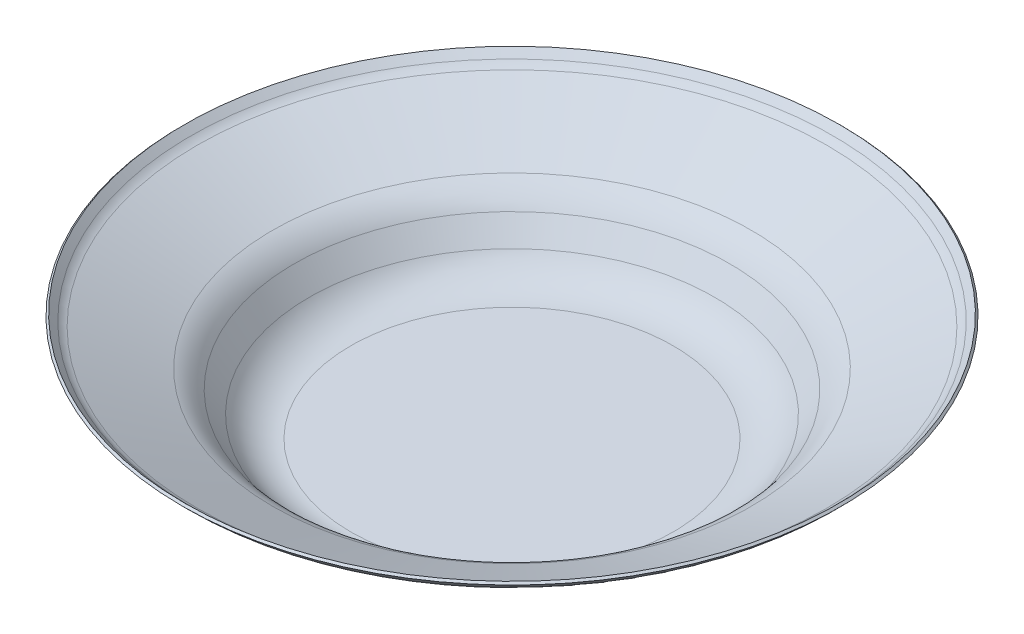
from build123d import *


with BuildPart() as part:
    # Sketch1 → Revolve-Thin2 (revolve)
    with BuildSketch(Plane.XY, mode=Mode.PRIVATE) as revolve_thin2_sk:
        with BuildLine():
            Line((0, 0), (-30.323190326, 0))
            ThreePointArc((-30.323190326, 0), (-34.9291722, 1.123912406), (-38.499810041, 4.243013806))
            Line((-38.499810041, 4.243013806), (-41.339639807, 8.276410321))
            ThreePointArc((-41.339639807, 8.276410321), (-43.060923254, 10.156742614), (-45.201704548, 11.540766343))
            Line((-45.201704548, 11.540766343), (-59.366864821, 18.315408212))
            ThreePointArc((-59.366864821, 18.315408212), (-60.097449611, 18.744382189), (-60.74512124, 19.290545415))
            Line((-60.74512124, 19.290545415), (-61.963641622, 20.509065797))
            Line((-61.963641622, 20.509065797), (-61.610088232, 20.862619188))
            Line((-61.610088232, 20.862619188), (-60.391567849, 19.644098805))
            ThreePointArc((-60.391567849, 19.644098805), (-59.808663383, 19.152551902), (-59.151137072, 18.766475323))
            Line((-59.151137072, 18.766475323), (-44.9859768, 11.991833454))
            ThreePointArc((-44.9859768, 11.991833454), (-42.73815644, 10.538608538), (-40.930808821, 8.56425963))
            Line((-40.930808821, 8.56425963), (-38.090979055, 4.530863116))
            ThreePointArc((-38.090979055, 4.530863116), (-34.698873107, 1.567716786), (-30.323190326, 0.5))
            Line((-30.323190326, 0.5), (0, 0.5))
            Line((0, 0.5), (0, 0))
        make_face()
    revolve(revolve_thin2_sk.sketch.rotate(Axis((0, 28.049813209, 0), (0, -1, 0)), 270), axis=Axis((0, 28.049813209, 0), (0, -1, 0)))


solid = part.part
